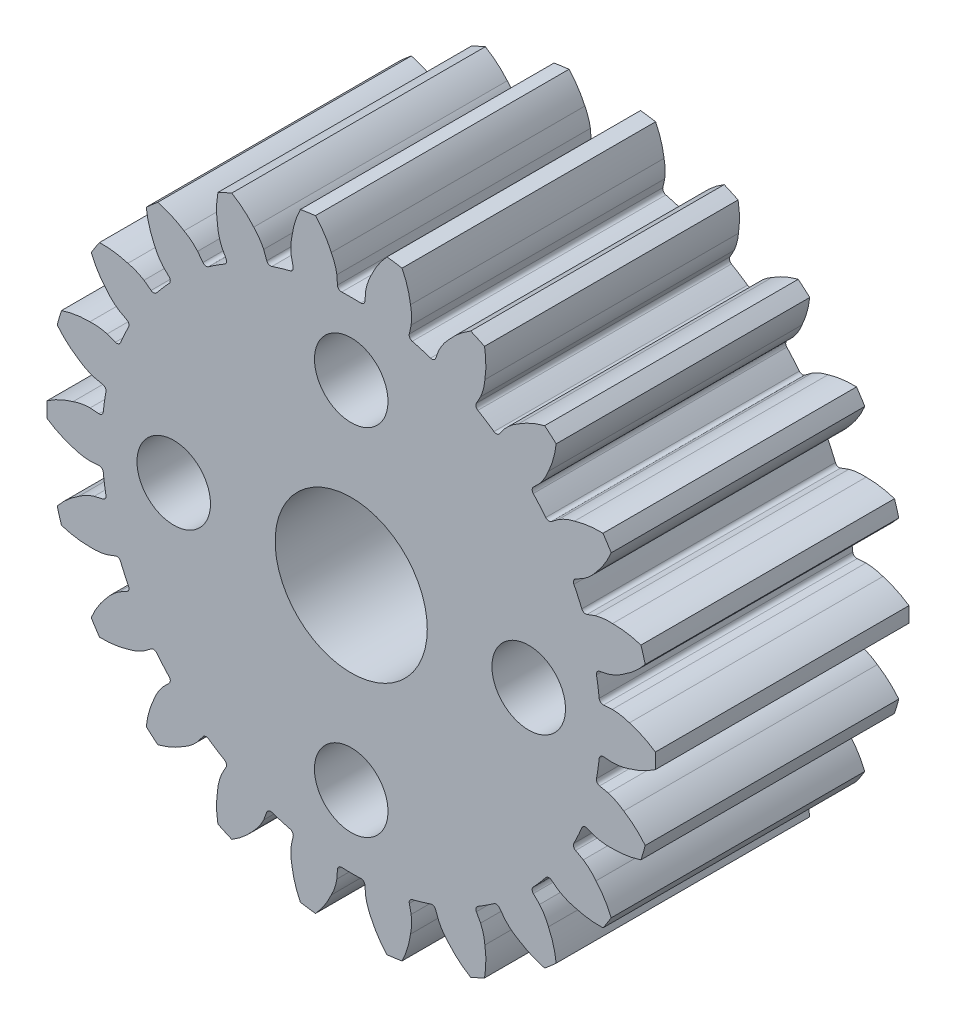
from build123d import *

# Parameters (mm, degrees)
ESBO_O1_R                = 12
RESSALTO_EXTRUS_O1_DEPTH = 5
CORTE_EXTRUS_O1_DEPTH    = 20.697715604
PADR_OCIRCULAR2_COUNT    = 22
ESBO_O3_R                = 3
ESBO_O3_R_2              = 1.45
CORTE_EXTRUS_O3_DEPTH    = 20.647204794
RESSALTO_EXTRUS_O2_DEPTH = 5
PADR_O_LINEAR6_COUNT     = 32
PADR_O_LINEAR6_PITCH     = 3.14
ESBO_O6_W                = 10
ESBO_O6_H                = 10
RESSALTO_EXTRUS_O4_DEPTH = 100


with BuildPart() as part:
    # Esboço1 → Ressalto-extrusão1 (new, symmetric)
    with BuildSketch(Plane.XY):
        Circle(ESBO_O1_R)
    extrude(amount=RESSALTO_EXTRUS_O1_DEPTH, both=True)

    # Esboço2 → Corte-extrusão1 (cut, through all)
    with BuildSketch(Plane.XY.offset(5)):
        with BuildLine():
            Line((0.567385201, 10.321116263), (0.542582109, 9.974246377))
            ThreePointArc((0.542582109, 9.974246377), (0.48975293, 9.866487695), (0.376857463, 9.825775667))
            ThreePointArc((0.376857463, 9.825775667), (0, 9.833), (-0.376857463, 9.825775667))
            ThreePointArc((-0.376857463, 9.825775667), (-0.48975293, 9.866487695), (-0.542582109, 9.974246377))
            Line((-0.542582109, 9.974246377), (-0.567385201, 10.321116263))
            ThreePointArc((-0.567385201, 10.321116263), (-0.648681564, 10.655656512), (-0.784556927, 10.97198571))
            ThreePointArc((-0.784556927, 10.97198571), (-1.058542859, 11.469985403), (-1.409731809, 11.916906319))
            ThreePointArc((-1.409731809, 11.916906319), (0, 12), (1.409731809, 11.916906319))
            ThreePointArc((1.409731809, 11.916906319), (1.058542859, 11.469985403), (0.784556927, 10.97198571))
            ThreePointArc((0.784556927, 10.97198571), (0.648681564, 10.655656512), (0.567385201, 10.321116263))
        make_face()
    corte_extrus_o1 = extrude(amount=-CORTE_EXTRUS_O1_DEPTH, mode=Mode.SUBTRACT)

    # PadrãoCircular2: Corte-extrusão1 ×22 about axis
    padr_ocircular2_axis = Axis((0, 0, 5), (0, 0, 1))
    for i in range(1, PADR_OCIRCULAR2_COUNT):
        add(corte_extrus_o1.rotate(padr_ocircular2_axis, i * 360 / PADR_OCIRCULAR2_COUNT), mode=Mode.SUBTRACT)

    # Esboço3 → Corte-extrusão3 (cut, through all)
    with BuildSketch(Plane.XY.offset(5)):
        Circle(ESBO_O3_R)
        with Locations((0, 7)):
            Circle(ESBO_O3_R_2)
        with Locations((0, -7)):
            Circle(ESBO_O3_R_2)
        with Locations((-7, 0)):
            Circle(ESBO_O3_R_2)
        with Locations((7, 0)):
            Circle(ESBO_O3_R_2)
    extrude(amount=-CORTE_EXTRUS_O3_DEPTH, mode=Mode.SUBTRACT)


with BuildPart() as body_2:
    # Esboço4 → Ressalto-extrusão2 (new, symmetric)
    with BuildSketch(Plane.XY):
        with BuildLine():
            Line((1.180278062, 12.118404029), (0.43319056, 10.065797986))
            ThreePointArc((0.43319056, 10.065797986), (0.396578942, 10.018084796), (0.339221298, 10))
            Line((0.339221298, 10), (-0.339221298, 10))
            ThreePointArc((-0.339221298, 10), (-0.396578942, 10.018084796), (-0.43319056, 10.065797986))
            Line((-0.43319056, 10.065797986), (-1.180278062, 12.118404029))
            ThreePointArc((-1.180278062, 12.118404029), (-1.253501299, 12.213830409), (-1.368216586, 12.25))
            Line((-1.368216586, 12.25), (-1.570795, 12.25))
            Line((-1.570795, 12.25), (-1.570795, 22.25))
            Line((-1.570795, 22.25), (1.570795, 22.25))
            Line((1.570795, 22.25), (1.570795, 12.25))
            Line((1.570795, 12.25), (1.368216586, 12.25))
            ThreePointArc((1.368216586, 12.25), (1.253501299, 12.213830409), (1.180278062, 12.118404029))
        make_face()
    ressalto_extrus_o2 = extrude(amount=RESSALTO_EXTRUS_O2_DEPTH, both=True)



with BuildPart() as padr_o_linear6_1:
    # Padrão linear6: pattern copy
    add(ressalto_extrus_o2.moved(Location(Vector(1, 0, 0) * (1 * PADR_O_LINEAR6_PITCH))))


with BuildPart() as padr_o_linear6_2:
    # Padrão linear6: pattern copy
    add(ressalto_extrus_o2.moved(Location(Vector(1, 0, 0) * (2 * PADR_O_LINEAR6_PITCH))))


with BuildPart() as padr_o_linear6_3:
    # Padrão linear6: pattern copy
    add(ressalto_extrus_o2.moved(Location(Vector(1, 0, 0) * (3 * PADR_O_LINEAR6_PITCH))))


with BuildPart() as padr_o_linear6_4:
    # Padrão linear6: pattern copy
    add(ressalto_extrus_o2.moved(Location(Vector(1, 0, 0) * (4 * PADR_O_LINEAR6_PITCH))))


with BuildPart() as padr_o_linear6_5:
    # Padrão linear6: pattern copy
    add(ressalto_extrus_o2.moved(Location(Vector(1, 0, 0) * (5 * PADR_O_LINEAR6_PITCH))))


with BuildPart() as padr_o_linear6_6:
    # Padrão linear6: pattern copy
    add(ressalto_extrus_o2.moved(Location(Vector(1, 0, 0) * (6 * PADR_O_LINEAR6_PITCH))))


with BuildPart() as padr_o_linear6_7:
    # Padrão linear6: pattern copy
    add(ressalto_extrus_o2.moved(Location(Vector(1, 0, 0) * (7 * PADR_O_LINEAR6_PITCH))))


with BuildPart() as padr_o_linear6_8:
    # Padrão linear6: pattern copy
    add(ressalto_extrus_o2.moved(Location(Vector(1, 0, 0) * (8 * PADR_O_LINEAR6_PITCH))))


with BuildPart() as padr_o_linear6_9:
    # Padrão linear6: pattern copy
    add(ressalto_extrus_o2.moved(Location(Vector(1, 0, 0) * (9 * PADR_O_LINEAR6_PITCH))))


with BuildPart() as padr_o_linear6_10:
    # Padrão linear6: pattern copy
    add(ressalto_extrus_o2.moved(Location(Vector(1, 0, 0) * (10 * PADR_O_LINEAR6_PITCH))))


with BuildPart() as padr_o_linear6_11:
    # Padrão linear6: pattern copy
    add(ressalto_extrus_o2.moved(Location(Vector(1, 0, 0) * (11 * PADR_O_LINEAR6_PITCH))))


with BuildPart() as padr_o_linear6_12:
    # Padrão linear6: pattern copy
    add(ressalto_extrus_o2.moved(Location(Vector(1, 0, 0) * (12 * PADR_O_LINEAR6_PITCH))))


with BuildPart() as padr_o_linear6_13:
    # Padrão linear6: pattern copy
    add(ressalto_extrus_o2.moved(Location(Vector(1, 0, 0) * (13 * PADR_O_LINEAR6_PITCH))))


with BuildPart() as padr_o_linear6_14:
    # Padrão linear6: pattern copy
    add(ressalto_extrus_o2.moved(Location(Vector(1, 0, 0) * (14 * PADR_O_LINEAR6_PITCH))))


with BuildPart() as padr_o_linear6_15:
    # Padrão linear6: pattern copy
    add(ressalto_extrus_o2.moved(Location(Vector(1, 0, 0) * (15 * PADR_O_LINEAR6_PITCH))))


with BuildPart() as padr_o_linear6_16:
    # Padrão linear6: pattern copy
    add(ressalto_extrus_o2.moved(Location(Vector(1, 0, 0) * (16 * PADR_O_LINEAR6_PITCH))))


with BuildPart() as padr_o_linear6_17:
    # Padrão linear6: pattern copy
    add(ressalto_extrus_o2.moved(Location(Vector(1, 0, 0) * (17 * PADR_O_LINEAR6_PITCH))))


with BuildPart() as padr_o_linear6_18:
    # Padrão linear6: pattern copy
    add(ressalto_extrus_o2.moved(Location(Vector(1, 0, 0) * (18 * PADR_O_LINEAR6_PITCH))))


with BuildPart() as padr_o_linear6_19:
    # Padrão linear6: pattern copy
    add(ressalto_extrus_o2.moved(Location(Vector(1, 0, 0) * (19 * PADR_O_LINEAR6_PITCH))))


with BuildPart() as padr_o_linear6_20:
    # Padrão linear6: pattern copy
    add(ressalto_extrus_o2.moved(Location(Vector(1, 0, 0) * (20 * PADR_O_LINEAR6_PITCH))))


with BuildPart() as padr_o_linear6_21:
    # Padrão linear6: pattern copy
    add(ressalto_extrus_o2.moved(Location(Vector(1, 0, 0) * (21 * PADR_O_LINEAR6_PITCH))))


with BuildPart() as padr_o_linear6_22:
    # Padrão linear6: pattern copy
    add(ressalto_extrus_o2.moved(Location(Vector(1, 0, 0) * (22 * PADR_O_LINEAR6_PITCH))))


with BuildPart() as padr_o_linear6_23:
    # Padrão linear6: pattern copy
    add(ressalto_extrus_o2.moved(Location(Vector(1, 0, 0) * (23 * PADR_O_LINEAR6_PITCH))))


with BuildPart() as padr_o_linear6_24:
    # Padrão linear6: pattern copy
    add(ressalto_extrus_o2.moved(Location(Vector(1, 0, 0) * (24 * PADR_O_LINEAR6_PITCH))))


with BuildPart() as padr_o_linear6_25:
    # Padrão linear6: pattern copy
    add(ressalto_extrus_o2.moved(Location(Vector(1, 0, 0) * (25 * PADR_O_LINEAR6_PITCH))))


with BuildPart() as padr_o_linear6_26:
    # Padrão linear6: pattern copy
    add(ressalto_extrus_o2.moved(Location(Vector(1, 0, 0) * (26 * PADR_O_LINEAR6_PITCH))))


with BuildPart() as padr_o_linear6_27:
    # Padrão linear6: pattern copy
    add(ressalto_extrus_o2.moved(Location(Vector(1, 0, 0) * (27 * PADR_O_LINEAR6_PITCH))))


with BuildPart() as padr_o_linear6_28:
    # Padrão linear6: pattern copy
    add(ressalto_extrus_o2.moved(Location(Vector(1, 0, 0) * (28 * PADR_O_LINEAR6_PITCH))))


with BuildPart() as padr_o_linear6_29:
    # Padrão linear6: pattern copy
    add(ressalto_extrus_o2.moved(Location(Vector(1, 0, 0) * (29 * PADR_O_LINEAR6_PITCH))))


with BuildPart() as padr_o_linear6_30:
    # Padrão linear6: pattern copy
    add(ressalto_extrus_o2.moved(Location(Vector(1, 0, 0) * (30 * PADR_O_LINEAR6_PITCH))))


with BuildPart() as padr_o_linear6_31:
    # Padrão linear6: pattern copy
    add(ressalto_extrus_o2.moved(Location(Vector(1, 0, 0) * (31 * PADR_O_LINEAR6_PITCH))))


with BuildPart() as body_2_1:
    add(body_2.part)

    add(padr_o_linear6_1.part)  # Ressalto-extrusão4 merges Padrão linear6_1

    add(padr_o_linear6_2.part)  # Ressalto-extrusão4 merges Padrão linear6_2

    add(padr_o_linear6_3.part)  # Ressalto-extrusão4 merges Padrão linear6_3

    add(padr_o_linear6_4.part)  # Ressalto-extrusão4 merges Padrão linear6_4

    add(padr_o_linear6_5.part)  # Ressalto-extrusão4 merges Padrão linear6_5

    add(padr_o_linear6_6.part)  # Ressalto-extrusão4 merges Padrão linear6_6

    add(padr_o_linear6_7.part)  # Ressalto-extrusão4 merges Padrão linear6_7

    add(padr_o_linear6_8.part)  # Ressalto-extrusão4 merges Padrão linear6_8

    add(padr_o_linear6_9.part)  # Ressalto-extrusão4 merges Padrão linear6_9

    add(padr_o_linear6_10.part)  # Ressalto-extrusão4 merges Padrão linear6_10

    add(padr_o_linear6_11.part)  # Ressalto-extrusão4 merges Padrão linear6_11

    add(padr_o_linear6_12.part)  # Ressalto-extrusão4 merges Padrão linear6_12

    add(padr_o_linear6_13.part)  # Ressalto-extrusão4 merges Padrão linear6_13

    add(padr_o_linear6_14.part)  # Ressalto-extrusão4 merges Padrão linear6_14

    add(padr_o_linear6_15.part)  # Ressalto-extrusão4 merges Padrão linear6_15

    add(padr_o_linear6_16.part)  # Ressalto-extrusão4 merges Padrão linear6_16

    add(padr_o_linear6_17.part)  # Ressalto-extrusão4 merges Padrão linear6_17

    add(padr_o_linear6_18.part)  # Ressalto-extrusão4 merges Padrão linear6_18

    add(padr_o_linear6_19.part)  # Ressalto-extrusão4 merges Padrão linear6_19

    add(padr_o_linear6_20.part)  # Ressalto-extrusão4 merges Padrão linear6_20

    add(padr_o_linear6_21.part)  # Ressalto-extrusão4 merges Padrão linear6_21

    add(padr_o_linear6_22.part)  # Ressalto-extrusão4 merges Padrão linear6_22

    add(padr_o_linear6_23.part)  # Ressalto-extrusão4 merges Padrão linear6_23

    add(padr_o_linear6_24.part)  # Ressalto-extrusão4 merges Padrão linear6_24

    add(padr_o_linear6_25.part)  # Ressalto-extrusão4 merges Padrão linear6_25

    add(padr_o_linear6_26.part)  # Ressalto-extrusão4 merges Padrão linear6_26

    add(padr_o_linear6_27.part)  # Ressalto-extrusão4 merges Padrão linear6_27

    add(padr_o_linear6_28.part)  # Ressalto-extrusão4 merges Padrão linear6_28

    add(padr_o_linear6_29.part)  # Ressalto-extrusão4 merges Padrão linear6_29

    add(padr_o_linear6_30.part)  # Ressalto-extrusão4 merges Padrão linear6_30

    add(padr_o_linear6_31.part)  # Ressalto-extrusão4 merges Padrão linear6_31
    # Esboço6 → Ressalto-extrusão4 (add)
    with BuildSketch(Plane.ZY.offset(1.570795)):
        with Locations((0, 17.25)):
            Rectangle(ESBO_O6_W, ESBO_O6_H)
    extrude(amount=-RESSALTO_EXTRUS_O4_DEPTH)


solid = part.part
